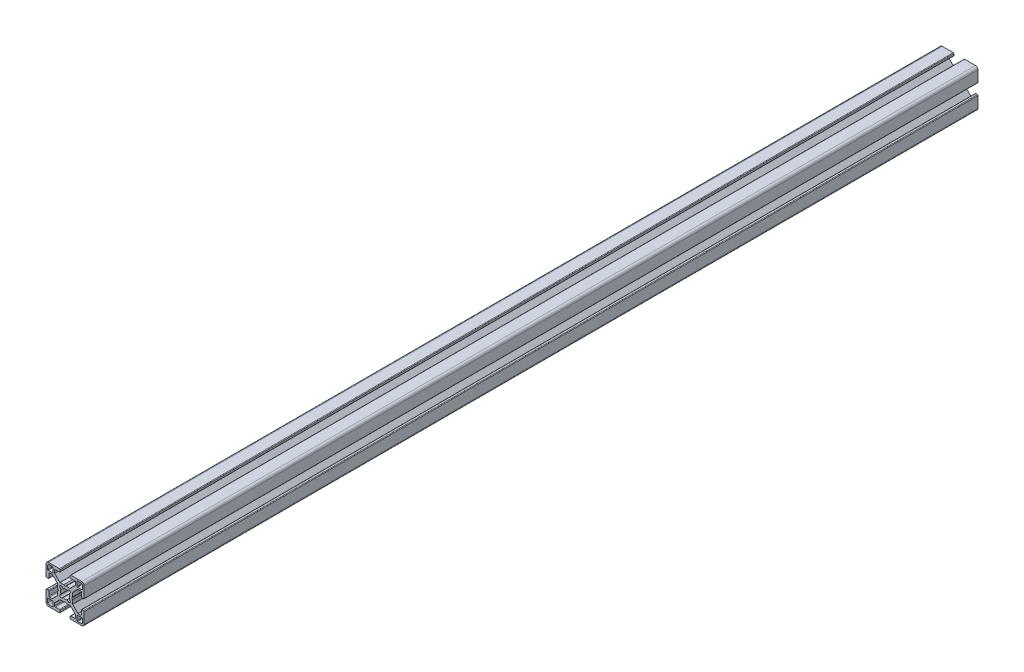
from build123d import *

# Parameters (mm, degrees)
EXTRUDE1_DEPTH = 702


with BuildPart() as part:
    # Sketch1 → Extrude1 (new body)
    with BuildSketch(Plane.XY):
        with BuildLine():
            Line((12.74247465, -4.5), (12.74247465, -7.732519321))
            ThreePointArc((12.74247465, -7.732519321), (12.602449697, -8.097296796), (12.242781236, -8.249967))
            Line((12.242781236, -8.249967), (10.260188032, -8.249967))
            ThreePointArc((10.260188032, -8.249967), (10.068847082, -8.211906919), (9.906636056, -8.103520976))
            Line((9.906636056, -8.103520976), (5.981117769, -4.178002689))
            ThreePointArc((5.981117769, -4.178002689), (5.872731827, -4.015791664), (5.834671745, -3.824450713))
            Line((5.834671745, -3.824450713), (5.834671745, -1.01249595))
            Line((5.834671745, -1.01249595), (5.324673785, -0.06249975))
            Line((5.324673785, -0.06249975), (5.834671745, 0.88749645))
            Line((5.834671745, 0.88749645), (5.834671745, 3.824450713))
            ThreePointArc((5.834671745, 3.824450713), (5.872731827, 4.015791664), (5.981117769, 4.178002689))
            Line((5.981117769, 4.178002689), (9.906636056, 8.103520976))
            ThreePointArc((9.906636056, 8.103520976), (10.068847082, 8.211906919), (10.260188032, 8.249967))
            Line((10.260188032, 8.249967), (12.242781236, 8.249967))
            ThreePointArc((12.242781236, 8.249967), (12.602449697, 8.097296796), (12.74247465, 7.732519321))
            Line((12.74247465, 7.732519321), (12.74247465, 4.5))
            ThreePointArc((12.74247465, 4.5), (12.88892126, 4.146446609), (13.24247465, 4))
            Line((13.24247465, 4), (14.49994, 4))
            ThreePointArc((14.49994, 4), (14.853493391, 4.146446609), (14.99994, 4.5))
            Line((14.99994, 4.5), (14.99994, 12.999948))
            ThreePointArc((14.99994, 12.999948), (14.414155906, 14.414155906), (12.999948, 14.99994))
            Line((12.999948, 14.99994), (4.5, 14.99994))
            ThreePointArc((4.5, 14.99994), (4.146446609, 14.853493391), (4, 14.49994))
            Line((4, 14.49994), (4, 13.24247465))
            ThreePointArc((4, 13.24247465), (4.146446609, 12.88892126), (4.5, 12.74247465))
            Line((4.5, 12.74247465), (7.732519321, 12.74247465))
            ThreePointArc((7.732519321, 12.74247465), (8.097296796, 12.602449697), (8.249967, 12.242781236))
            Line((8.249967, 12.242781236), (8.249967, 10.260188032))
            ThreePointArc((8.249967, 10.260188032), (8.211906919, 10.068847082), (8.103520976, 9.906636056))
            Line((8.103520976, 9.906636056), (4.178002689, 5.981117769))
            ThreePointArc((4.178002689, 5.981117769), (4.015791664, 5.872731827), (3.824450713, 5.834671745))
            Line((3.824450713, 5.834671745), (0.9499962, 5.834671745))
            Line((0.9499962, 5.834671745), (0, 5.324673785))
            Line((0, 5.324673785), (-0.9499962, 5.834671745))
            Line((-0.9499962, 5.834671745), (-3.824450713, 5.834671745))
            ThreePointArc((-3.824450713, 5.834671745), (-4.015791664, 5.872731827), (-4.178002689, 5.981117769))
            Line((-4.178002689, 5.981117769), (-8.103520976, 9.906636056))
            ThreePointArc((-8.103520976, 9.906636056), (-8.211906919, 10.068847082), (-8.249967, 10.260188032))
            Line((-8.249967, 10.260188032), (-8.249967, 12.242781236))
            ThreePointArc((-8.249967, 12.242781236), (-8.097296796, 12.602449697), (-7.732519321, 12.74247465))
            Line((-7.732519321, 12.74247465), (-4.5, 12.74247465))
            ThreePointArc((-4.5, 12.74247465), (-4.146446609, 12.88892126), (-4, 13.24247465))
            Line((-4, 13.24247465), (-4, 14.49994))
            ThreePointArc((-4, 14.49994), (-4.146446609, 14.853493391), (-4.5, 14.99994))
            Line((-4.5, 14.99994), (-12.999948, 14.99994))
            ThreePointArc((-12.999948, 14.99994), (-14.414155906, 14.414155906), (-14.99994, 12.999948))
            Line((-14.99994, 12.999948), (-14.99994, 4.5))
            ThreePointArc((-14.99994, 4.5), (-14.853493391, 4.146446609), (-14.49994, 4))
            Line((-14.49994, 4), (-13.24247465, 4))
            ThreePointArc((-13.24247465, 4), (-12.88892126, 4.146446609), (-12.74247465, 4.5))
            Line((-12.74247465, 4.5), (-12.74247465, 7.732519321))
            ThreePointArc((-12.74247465, 7.732519321), (-12.602449697, 8.097296796), (-12.242781236, 8.249967))
            Line((-12.242781236, 8.249967), (-10.260188032, 8.249967))
            ThreePointArc((-10.260188032, 8.249967), (-10.068847082, 8.211906919), (-9.906636056, 8.103520976))
            Line((-9.906636056, 8.103520976), (-5.981117769, 4.178002689))
            ThreePointArc((-5.981117769, 4.178002689), (-5.872731827, 4.015791664), (-5.834671745, 3.824450713))
            Line((-5.834671745, 3.824450713), (-5.834671745, 0.88749645))
            Line((-5.834671745, 0.88749645), (-5.324673785, -0.06249975))
            Line((-5.324673785, -0.06249975), (-5.834671745, -1.01249595))
            Line((-5.834671745, -1.01249595), (-5.834671745, -3.824450713))
            ThreePointArc((-5.834671745, -3.824450713), (-5.872731827, -4.015791664), (-5.981117769, -4.178002689))
            Line((-5.981117769, -4.178002689), (-9.906636056, -8.103520976))
            ThreePointArc((-9.906636056, -8.103520976), (-10.068847082, -8.211906919), (-10.260188032, -8.249967))
            Line((-10.260188032, -8.249967), (-12.242781236, -8.249967))
            ThreePointArc((-12.242781236, -8.249967), (-12.602449697, -8.097296796), (-12.74247465, -7.732519321))
            Line((-12.74247465, -7.732519321), (-12.74247465, -4.5))
            ThreePointArc((-12.74247465, -4.5), (-12.88892126, -4.146446609), (-13.24247465, -4))
            Line((-13.24247465, -4), (-14.49994, -4))
            ThreePointArc((-14.49994, -4), (-14.853493391, -4.146446609), (-14.99994, -4.5))
            Line((-14.99994, -4.5), (-14.99994, -12.999948))
            ThreePointArc((-14.99994, -12.999948), (-14.414155906, -14.414155906), (-12.999948, -14.99994))
            Line((-12.999948, -14.99994), (-4.5, -14.99994))
            ThreePointArc((-4.5, -14.99994), (-4.146446609, -14.853493391), (-4, -14.49994))
            Line((-4, -14.49994), (-4, -13.24247465))
            ThreePointArc((-4, -13.24247465), (-4.146446609, -12.88892126), (-4.5, -12.74247465))
            Line((-4.5, -12.74247465), (-7.732519321, -12.74247465))
            ThreePointArc((-7.732519321, -12.74247465), (-8.097296796, -12.602449697), (-8.249967, -12.242781236))
            Line((-8.249967, -12.242781236), (-8.249967, -10.260188032))
            ThreePointArc((-8.249967, -10.260188032), (-8.211906919, -10.068847082), (-8.103520976, -9.906636056))
            Line((-8.103520976, -9.906636056), (-4.178002689, -5.981117769))
            ThreePointArc((-4.178002689, -5.981117769), (-4.015791664, -5.872731827), (-3.824450713, -5.834671745))
            Line((-3.824450713, -5.834671745), (-0.9499962, -5.834671745))
            Line((-0.9499962, -5.834671745), (0, -5.324673785))
            Line((0, -5.324673785), (0.9499962, -5.834671745))
            Line((0.9499962, -5.834671745), (3.824450713, -5.834671745))
            ThreePointArc((3.824450713, -5.834671745), (4.015791664, -5.872731827), (4.178002689, -5.981117769))
            Line((4.178002689, -5.981117769), (8.103520976, -9.906636056))
            ThreePointArc((8.103520976, -9.906636056), (8.211906919, -10.068847082), (8.249967, -10.260188032))
            Line((8.249967, -10.260188032), (8.249967, -12.242781236))
            ThreePointArc((8.249967, -12.242781236), (8.097296796, -12.602449697), (7.732519321, -12.74247465))
            Line((7.732519321, -12.74247465), (4.5, -12.74247465))
            ThreePointArc((4.5, -12.74247465), (4.146446609, -12.88892126), (4, -13.24247465))
            Line((4, -13.24247465), (4, -14.49994))
            ThreePointArc((4, -14.49994), (4.146446609, -14.853493391), (4.5, -14.99994))
            Line((4.5, -14.99994), (12.999948, -14.99994))
            ThreePointArc((12.999948, -14.99994), (14.414155906, -14.414155906), (14.99994, -12.999948))
            Line((14.99994, -12.999948), (14.99994, -4.5))
            ThreePointArc((14.99994, -4.5), (14.853493391, -4.146446609), (14.49994, -4))
            Line((14.49994, -4), (13.24247465, -4))
            ThreePointArc((13.24247465, -4), (12.88892126, -4.146446609), (12.74247465, -4.5))
        make_face()
        with BuildLine():
            Line((9.499962, -13.318946724), (9.499962, -9.87996048))
            ThreePointArc((9.499962, -9.87996048), (9.611260978, -9.611260978), (9.87996048, -9.499962))
            Line((9.87996048, -9.499962), (13.318946724, -9.499962))
            ThreePointArc((13.318946724, -9.499962), (13.58835333, -9.61155387), (13.6999452, -9.880960476))
            Line((13.6999452, -9.880960476), (13.6999452, -12.6999492))
            ThreePointArc((13.6999452, -12.6999492), (13.407053153, -13.407053153), (12.6999492, -13.6999452))
            Line((12.6999492, -13.6999452), (9.880960476, -13.6999452))
            ThreePointArc((9.880960476, -13.6999452), (9.61155387, -13.58835333), (9.499962, -13.318946724))
        make_face(mode=Mode.SUBTRACT)
        with BuildLine():
            Line((-13.318946724, -9.499962), (-9.87996048, -9.499962))
            ThreePointArc((-9.87996048, -9.499962), (-9.611260978, -9.611260978), (-9.499962, -9.87996048))
            Line((-9.499962, -9.87996048), (-9.499962, -13.318946724))
            ThreePointArc((-9.499962, -13.318946724), (-9.61155387, -13.58835333), (-9.880960476, -13.6999452))
            Line((-9.880960476, -13.6999452), (-12.6999492, -13.6999452))
            ThreePointArc((-12.6999492, -13.6999452), (-13.407053153, -13.407053153), (-13.6999452, -12.6999492))
            Line((-13.6999452, -12.6999492), (-13.6999452, -9.880960476))
            ThreePointArc((-13.6999452, -9.880960476), (-13.58835333, -9.61155387), (-13.318946724, -9.499962))
        make_face(mode=Mode.SUBTRACT)
        with BuildLine():
            Line((-1.494225248, -3.198138712), (-2.473341823, -3.979927146))
            ThreePointArc((-2.473341823, -3.979927146), (-3.900227701, -3.900227701), (-3.979927146, -2.473341823))
            Line((-3.979927146, -2.473341823), (-3.198138712, -1.494225248))
            ThreePointArc((-3.198138712, -1.494225248), (-3.52998588, 0), (-3.198138712, 1.494225248))
            Line((-3.198138712, 1.494225248), (-3.979927146, 2.473341823))
            ThreePointArc((-3.979927146, 2.473341823), (-3.900227701, 3.900227701), (-2.473341823, 3.979927146))
            Line((-2.473341823, 3.979927146), (-1.494225248, 3.198138712))
            ThreePointArc((-1.494225248, 3.198138712), (0, 3.52998588), (1.494225248, 3.198138712))
            Line((1.494225248, 3.198138712), (2.473341823, 3.979927146))
            ThreePointArc((2.473341823, 3.979927146), (3.900227701, 3.900227701), (3.979927146, 2.473341823))
            Line((3.979927146, 2.473341823), (3.198138712, 1.494225248))
            ThreePointArc((3.198138712, 1.494225248), (3.52998588, 0), (3.198138712, -1.494225248))
            Line((3.198138712, -1.494225248), (3.979927146, -2.473341823))
            ThreePointArc((3.979927146, -2.473341823), (3.900227701, -3.900227701), (2.473341823, -3.979927146))
            Line((2.473341823, -3.979927146), (1.494225248, -3.198138712))
            ThreePointArc((1.494225248, -3.198138712), (0, -3.52998588), (-1.494225248, -3.198138712))
        make_face(mode=Mode.SUBTRACT)
        with BuildLine():
            Line((-9.499962, 13.318946724), (-9.499962, 9.87996048))
            ThreePointArc((-9.499962, 9.87996048), (-9.611260978, 9.611260978), (-9.87996048, 9.499962))
            Line((-9.87996048, 9.499962), (-13.318946724, 9.499962))
            ThreePointArc((-13.318946724, 9.499962), (-13.58835333, 9.61155387), (-13.6999452, 9.880960476))
            Line((-13.6999452, 9.880960476), (-13.6999452, 12.6999492))
            ThreePointArc((-13.6999452, 12.6999492), (-13.407053153, 13.407053153), (-12.6999492, 13.6999452))
            Line((-12.6999492, 13.6999452), (-9.880960476, 13.6999452))
            ThreePointArc((-9.880960476, 13.6999452), (-9.61155387, 13.58835333), (-9.499962, 13.318946724))
        make_face(mode=Mode.SUBTRACT)
        with BuildLine():
            Line((9.880960476, 13.6999452), (12.6999492, 13.6999452))
            ThreePointArc((12.6999492, 13.6999452), (13.407053153, 13.407053153), (13.6999452, 12.6999492))
            Line((13.6999452, 12.6999492), (13.6999452, 9.880960476))
            ThreePointArc((13.6999452, 9.880960476), (13.58835333, 9.61155387), (13.318946724, 9.499962))
            Line((13.318946724, 9.499962), (9.87996048, 9.499962))
            ThreePointArc((9.87996048, 9.499962), (9.611260978, 9.611260978), (9.499962, 9.87996048))
            Line((9.499962, 9.87996048), (9.499962, 13.318946724))
            ThreePointArc((9.499962, 13.318946724), (9.61155387, 13.58835333), (9.880960476, 13.6999452))
        make_face(mode=Mode.SUBTRACT)
    extrude(amount=-EXTRUDE1_DEPTH)


solid = part.part
